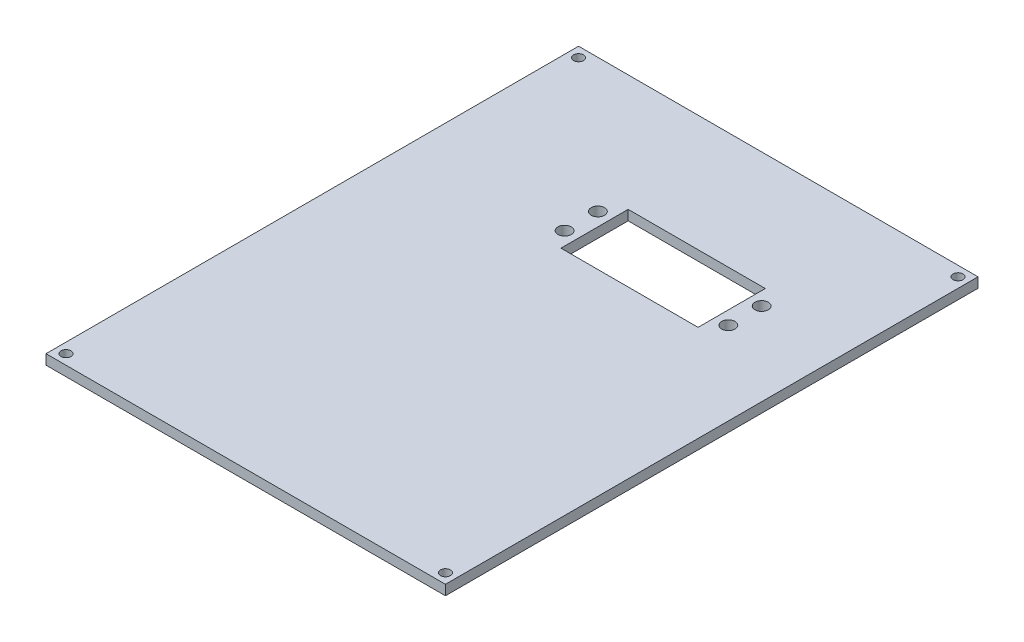
from build123d import *

# Parameters (mm, degrees)
SKETCH1_W           = 120
SKETCH1_H           = 160
SKETCH1_R           = 1.5
SKETCH1_R_2         = 2
SKETCH1_W_2         = 41.2
SKETCH1_H_2         = 20.2
BOSS_EXTRUDE1_DEPTH = 3


with BuildPart() as part:
    # Sketch1 → Boss-Extrude1 (new body)
    with BuildSketch(Plane(origin=(0, 0, 0), x_dir=(1, 0, 0), z_dir=(0, 1, 0))):
        with Locations((-60, 80)):
            Rectangle(SKETCH1_W, SKETCH1_H)
        with Locations(Location((-117, 157, 0), (0, 0, 270))):
            Circle(SKETCH1_R, mode=Mode.SUBTRACT)
        with Locations(Location((-3, 157, 0), (0, 0, 270))):
            Circle(SKETCH1_R, mode=Mode.SUBTRACT)
        with Locations(Location((-117, 3, 0), (0, 0, 270))):
            Circle(SKETCH1_R, mode=Mode.SUBTRACT)
        with Locations(Location((-3, 3, 0), (0, 0, 270))):
            Circle(SKETCH1_R, mode=Mode.SUBTRACT)
        with Locations(Location((-74.1, 119.9, 0), (0, 0, 270))):
            Circle(SKETCH1_R_2, mode=Mode.SUBTRACT)
        with Locations(Location((-74.1, 109.9, 0), (0, 0, 270))):
            Circle(SKETCH1_R_2, mode=Mode.SUBTRACT)
        with Locations(Location((-24.9, 119.9, 0), (0, 0, 270))):
            Circle(SKETCH1_R_2, mode=Mode.SUBTRACT)
        with Locations(Location((-24.9, 109.9, 0), (0, 0, 270))):
            Circle(SKETCH1_R_2, mode=Mode.SUBTRACT)
        with Locations((-49.5, 114.9)):
            Rectangle(SKETCH1_W_2, SKETCH1_H_2, mode=Mode.SUBTRACT)
    extrude(amount=BOSS_EXTRUDE1_DEPTH)


solid = part.part
